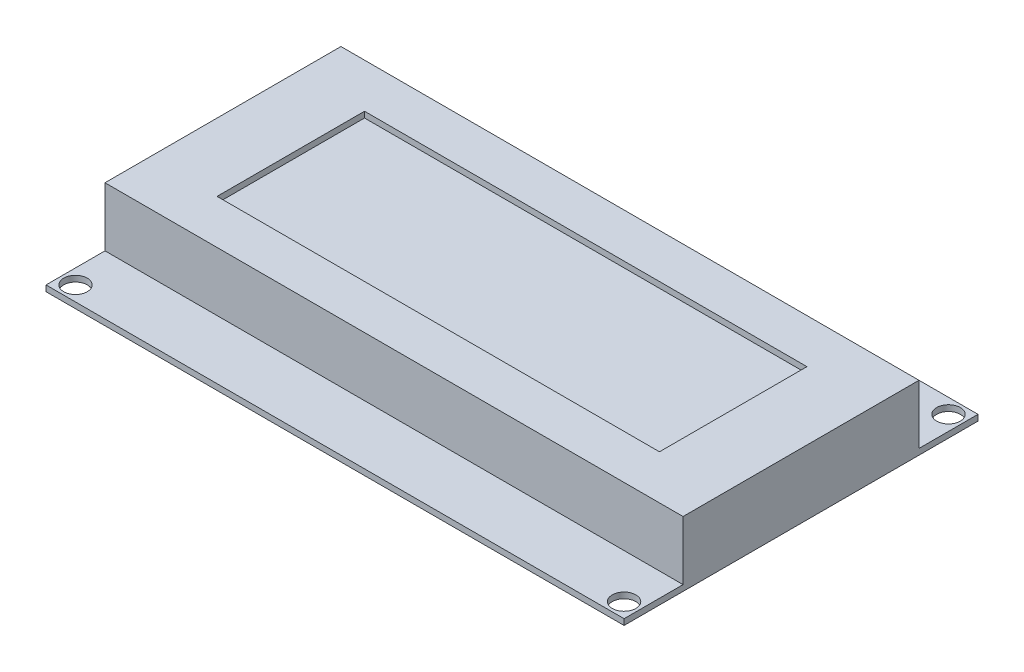
from build123d import *

# Parameters (mm, degrees)
ESQUISSE1_W             = 98
ESQUISSE1_H             = 60
ESQUISSE1_R             = 2
ESQUISSE1_R_2           = 0.637876667
BOSS_EXTRU_1_DEPTH      = 0.5
ESQUISSE3_W             = 98
ESQUISSE3_H             = 40
BOSS_EXTRU_2_DEPTH      = 10
ESQUISSE4_W             = 75
ESQUISSE4_H             = 25
ENL_V_MAT_EXTRU_1_DEPTH = 1
BOSS_EXTRU_4_DEPTH      = 10


with BuildPart() as part:
    # Esquisse1 → Boss.-Extru.1 (new, symmetric)
    with BuildSketch(Plane(origin=(0, 0, 0), x_dir=(1, 0, 0), z_dir=(0, 1, 0))):
        Rectangle(ESQUISSE1_W, ESQUISSE1_H)
        with Locations(Location((-46.5, 27.5, 0), (0, 0, 270))):
            Circle(ESQUISSE1_R, mode=Mode.SUBTRACT)
        with Locations(Location((46.5, 27.5, 0), (0, 0, 90))):
            Circle(ESQUISSE1_R, mode=Mode.SUBTRACT)
        with Locations(Location((46.5, -27.5, 0), (0, 0, 270))):
            Circle(ESQUISSE1_R, mode=Mode.SUBTRACT)
        with Locations(Location((-46.5, -27.5, 0), (0, 0, 90))):
            Circle(ESQUISSE1_R, mode=Mode.SUBTRACT)
        with Locations(Location((-39, 27.5, 0), (0, 0, 270))):
            Circle(ESQUISSE1_R_2, mode=Mode.SUBTRACT)
        with Locations(Location((-37, 27.5, 0), (0, 0, 270))):
            Circle(ESQUISSE1_R_2, mode=Mode.SUBTRACT)
        with Locations(Location((-35, 27.5, 0), (0, 0, 270))):
            Circle(ESQUISSE1_R_2, mode=Mode.SUBTRACT)
        with Locations(Location((-33, 27.5, 0), (0, 0, 270))):
            Circle(ESQUISSE1_R_2, mode=Mode.SUBTRACT)
        with Locations(Location((-31, 27.5, 0), (0, 0, 270))):
            Circle(ESQUISSE1_R_2, mode=Mode.SUBTRACT)
        with Locations(Location((-29, 27.5, 0), (0, 0, 270))):
            Circle(ESQUISSE1_R_2, mode=Mode.SUBTRACT)
        with Locations(Location((-27, 27.5, 0), (0, 0, 270))):
            Circle(ESQUISSE1_R_2, mode=Mode.SUBTRACT)
        with Locations(Location((-25, 27.5, 0), (0, 0, 270))):
            Circle(ESQUISSE1_R_2, mode=Mode.SUBTRACT)
        with Locations(Location((-23, 27.5, 0), (0, 0, 270))):
            Circle(ESQUISSE1_R_2, mode=Mode.SUBTRACT)
        with Locations(Location((-21, 27.5, 0), (0, 0, 270))):
            Circle(ESQUISSE1_R_2, mode=Mode.SUBTRACT)
        with Locations(Location((-19, 27.5, 0), (0, 0, 270))):
            Circle(ESQUISSE1_R_2, mode=Mode.SUBTRACT)
        with Locations(Location((-17, 27.5, 0), (0, 0, 270))):
            Circle(ESQUISSE1_R_2, mode=Mode.SUBTRACT)
        with Locations(Location((-15, 27.5, 0), (0, 0, 270))):
            Circle(ESQUISSE1_R_2, mode=Mode.SUBTRACT)
        with Locations(Location((-13, 27.5, 0), (0, 0, 270))):
            Circle(ESQUISSE1_R_2, mode=Mode.SUBTRACT)
        with Locations(Location((-11, 27.5, 0), (0, 0, 270))):
            Circle(ESQUISSE1_R_2, mode=Mode.SUBTRACT)
        with Locations(Location((-9, 27.5, 0), (0, 0, 270))):
            Circle(ESQUISSE1_R_2, mode=Mode.SUBTRACT)
    extrude(amount=BOSS_EXTRU_1_DEPTH, both=True)

    # Esquisse3 → Boss.-Extru.2 (add)
    with BuildSketch(Plane(origin=(0, 0.5, 0), x_dir=(1, 0, 0), z_dir=(0, 1, 0))):
        Rectangle(ESQUISSE3_W, ESQUISSE3_H)
    extrude(amount=BOSS_EXTRU_2_DEPTH)

    # Esquisse4 → Enlèv. mat.-Extru.1 (cut)
    with BuildSketch(Plane(origin=(0, 10.5, 0), x_dir=(1, 0, 0), z_dir=(0, 1, 0))):
        Rectangle(ESQUISSE4_W, ESQUISSE4_H)
    extrude(amount=-ENL_V_MAT_EXTRU_1_DEPTH, mode=Mode.SUBTRACT)

    # Esquisse5 → Boss.-Extru.4 (add)
    with BuildSketch(Plane.XZ.offset(0.5)):
        Polygon((-40, -27.25), (-40, -22), (-47, -22), (-47, -13.5), (-40, -13.5), (-40, -8.25), (2, -8.25), (2, -27.25), align=None)
    extrude(amount=BOSS_EXTRU_4_DEPTH)


solid = part.part
